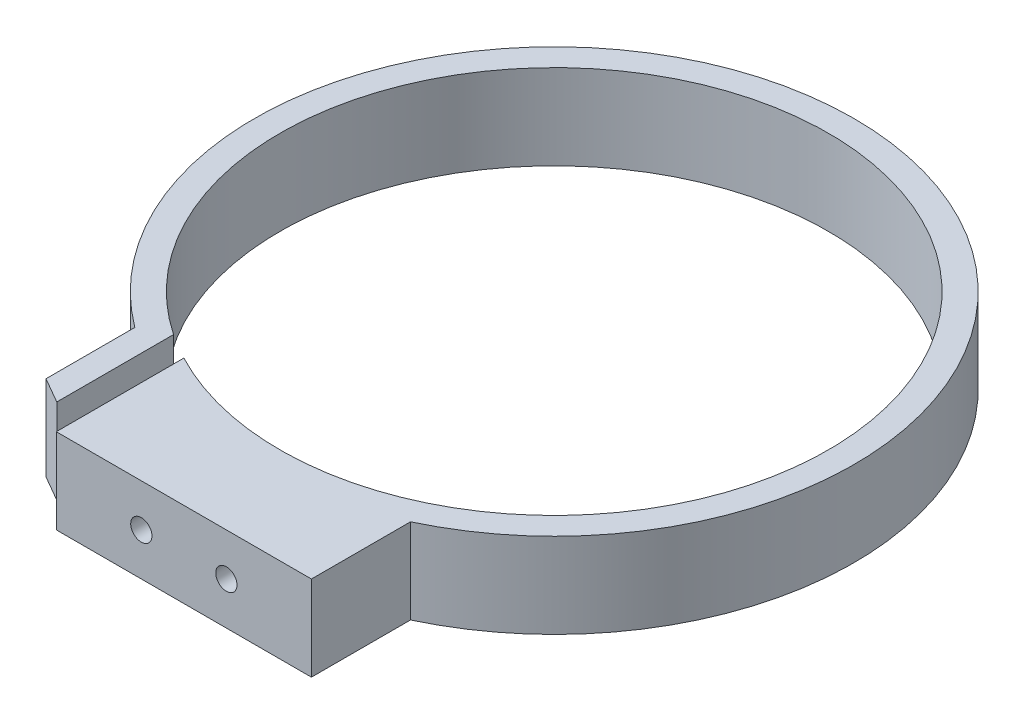
from build123d import *

# Parameters (mm, degrees)
SKETCH_1_R            = 32.25
EXTRUDE_1_DEPTH       = 10
SKETCH_4_W            = 3
SKETCH_4_H            = 8.186725545
CUT_EXTRUDE_2_DEPTH   = 10
EXTRUDE_5_DEPTH       = 10
HOLE_WIZARD_M32_D     = 3.4
HOLE_WIZARD_M32_DEPTH = 3
M3X0_51_D             = 2.5
M3X0_51_DEPTH         = 8.5
M3X0_51_TIP           = 0.751075774
M3X0_52_D             = 2.5
M3X0_52_DEPTH         = 8.5
M3X0_52_TIP           = 0.751075774


with BuildPart() as part:
    # Эскиз1 → Бобышка-Вытянуть1 (new body)
    with BuildSketch(Plane(origin=(0, 0, 0), x_dir=(1, 0, 0), z_dir=(0, 1, 0))):
        with BuildLine():
            Line((-15, -31.899255477), (-15, -43.549299466))
            Line((-15, -43.549299466), (15, -43.549299466))
            Line((15, -43.549299466), (15, -31.899255477))
            ThreePointArc((15, -31.899255477), (0, 35.25), (-15, -31.899255477))
        make_face()
        with Locations(Location((0, 0, 0), (0, 0, 270))):
            Circle(SKETCH_1_R, mode=Mode.SUBTRACT)
    extrude(amount=EXTRUDE_1_DEPTH)

    # Эскиз4 → Вырез-Вытянуть2 (cut)
    with BuildSketch(Plane(origin=(0, 10, 0), x_dir=(1, 0, 0), z_dir=(0, 1, 0))):
        with Locations((-16.5, -27.805892705)):
            Rectangle(SKETCH_4_W, SKETCH_4_H)
    extrude(amount=-CUT_EXTRUDE_2_DEPTH, mode=Mode.SUBTRACT)

    # Эскиз11 → Бобышка-Вытянуть5 (add)
    with BuildSketch(Plane(origin=(0, 10, 0), x_dir=(1, 0, 0), z_dir=(0, 1, 0))):
        Polygon((-18, -26.759344162), (-21, -26.759344162), (-21, -38.759344162), (-18, -40.49139497), align=None)
    extrude(amount=-EXTRUDE_5_DEPTH)

    # Отверстие с зазором M32
    with Locations(Plane.ZY.offset(21)):
        with Locations((33.759344162, 5)):
            Hole(HOLE_WIZARD_M32_D / 2, depth=HOLE_WIZARD_M32_DEPTH)

    # Отверстие обработанное метчиком M3x0.51
    with Locations(Plane.ZY.offset(15)):
        with Locations((33.759344162, 5)):
            Hole(M3X0_51_D / 2, depth=M3X0_51_DEPTH)
            with Locations((0, 0, -(M3X0_51_DEPTH + M3X0_51_TIP / 2))):  # 118° drill point
                Cone(0, M3X0_51_D / 2, M3X0_51_TIP, mode=Mode.SUBTRACT)

    # Отверстие обработанное метчиком M3x0.52
    with Locations(Plane.XY.offset(43.549299466)):
        with Locations((-5, 5), (5, 5)):
            Hole(M3X0_52_D / 2, depth=M3X0_52_DEPTH)
            with Locations((0, 0, -(M3X0_52_DEPTH + M3X0_52_TIP / 2))):  # 118° drill point
                Cone(0, M3X0_52_D / 2, M3X0_52_TIP, mode=Mode.SUBTRACT)


solid = part.part
